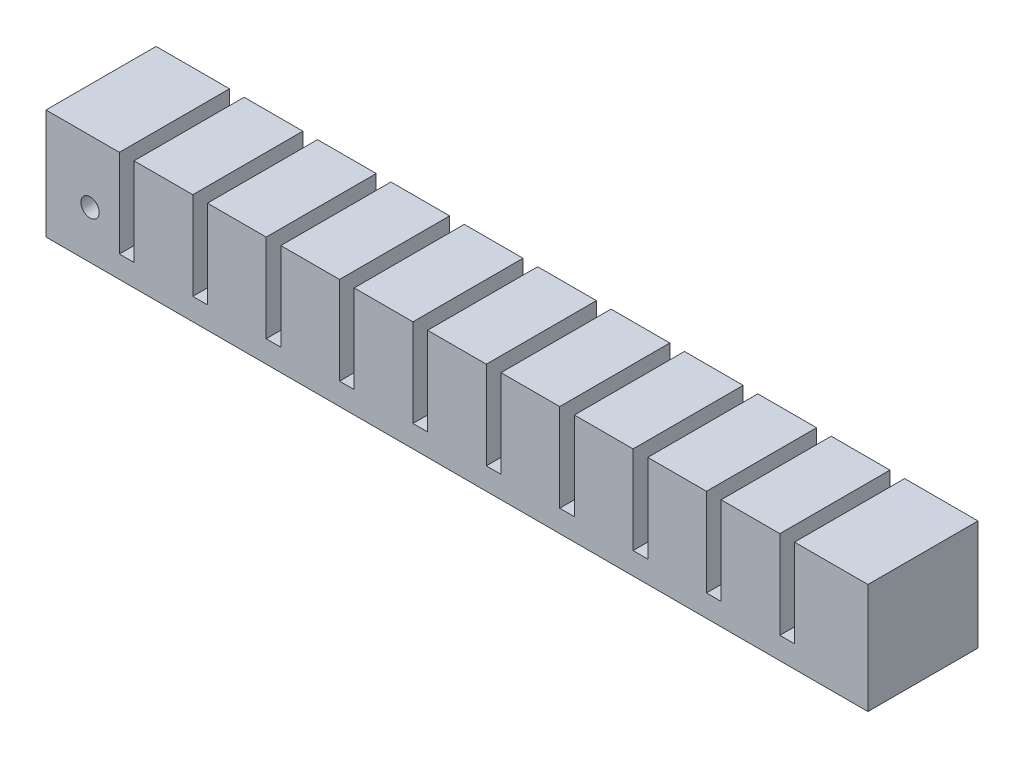
from build123d import *

# Parameters (mm, degrees)
SKETCH1_W                       = 8
SKETCH1_H                       = 15
FIRST_CHAMBER_BLOCK_DEPTH       = 15
SKETCH2_W                       = 6
SKETCH2_H                       = 11
FIRST_CHAMBER_CAVITY_DEPTH      = 13
SKETCH3_W                       = 15
SKETCH3_H                       = 3
CHAMBER_SPACER_DEPTH            = 2
PATTERN_CHAMBERS_COUNT          = 11
PATTERN_CHAMBERS_PITCH          = 10
SKETCH4_W                       = 15
SKETCH4_H                       = 12
THICKEN_END_1_DEPTH             = 2
SKETCH5_W                       = 15
SKETCH5_H                       = 15
THICKEN_END_2_DEPTH             = 2
SKETCH6_W                       = 94
SKETCH6_H                       = 2
CENTRAL_AIR_CHANNEL_DEPTH       = 2
SKETCH7_W                       = 108
SKETCH7_H                       = 13
SKETCH7_W_2                     = 106
SKETCH7_H_2                     = 11
BONDING_RIDGE_DEPTH             = 2
SKETCH9_W                       = 2
SKETCH9_H                       = 2.5
BONDING_BUMPS_DEPTH             = 2
PATTERN_BONDING_BUMPS_COUNT     = 10
PATTERN_BONDING_BUMPS_PITCH     = 10
SKIZZE1_W                       = 112
SKIZZE1_H                       = 15
SCHNITT_LINEAR_AUSTRAGEN1_DEPTH = 113.026782512
SKIZZE4_R                       = 1.25
SCHNITT_LINEAR_AUSTRAGEN3_DEPTH = 112.776562839


with BuildPart() as part:
    # Sketch1 → first chamber block (new body)
    with BuildSketch(Plane.XY):
        with Locations((4, 7.5)):
            Rectangle(SKETCH1_W, SKETCH1_H)
    extrude(amount=FIRST_CHAMBER_BLOCK_DEPTH)

    # Sketch2 → first chamber cavity (cut)
    with BuildSketch(Plane.XZ):
        with Locations((4, 7.5)):
            Rectangle(SKETCH2_W, SKETCH2_H)
    extrude(amount=-FIRST_CHAMBER_CAVITY_DEPTH, mode=Mode.SUBTRACT)

    # Sketch3 → chamber spacer (add)
    with BuildSketch(Plane(origin=(8, 0, 0), x_dir=(0, 0, -1), z_dir=(1, 0, 0))):
        with Locations((-7.5, 1.5)):
            Rectangle(SKETCH3_W, SKETCH3_H)
    extrude(amount=CHAMBER_SPACER_DEPTH)


with BuildPart() as pattern_chambers_1:
    # pattern chambers: pattern copy
    add(part.part.moved(Location(Vector(1, 0, 0) * (1 * PATTERN_CHAMBERS_PITCH))))


with BuildPart() as pattern_chambers_2:
    # pattern chambers: pattern copy
    add(part.part.moved(Location(Vector(1, 0, 0) * (2 * PATTERN_CHAMBERS_PITCH))))


with BuildPart() as pattern_chambers_3:
    # pattern chambers: pattern copy
    add(part.part.moved(Location(Vector(1, 0, 0) * (3 * PATTERN_CHAMBERS_PITCH))))


with BuildPart() as pattern_chambers_4:
    # pattern chambers: pattern copy
    add(part.part.moved(Location(Vector(1, 0, 0) * (4 * PATTERN_CHAMBERS_PITCH))))


with BuildPart() as pattern_chambers_5:
    # pattern chambers: pattern copy
    add(part.part.moved(Location(Vector(1, 0, 0) * (5 * PATTERN_CHAMBERS_PITCH))))


with BuildPart() as pattern_chambers_6:
    # pattern chambers: pattern copy
    add(part.part.moved(Location(Vector(1, 0, 0) * (6 * PATTERN_CHAMBERS_PITCH))))


with BuildPart() as pattern_chambers_7:
    # pattern chambers: pattern copy
    add(part.part.moved(Location(Vector(1, 0, 0) * (7 * PATTERN_CHAMBERS_PITCH))))


with BuildPart() as pattern_chambers_8:
    # pattern chambers: pattern copy
    add(part.part.moved(Location(Vector(1, 0, 0) * (8 * PATTERN_CHAMBERS_PITCH))))


with BuildPart() as pattern_chambers_9:
    # pattern chambers: pattern copy
    add(part.part.moved(Location(Vector(1, 0, 0) * (9 * PATTERN_CHAMBERS_PITCH))))


with BuildPart() as pattern_chambers_10:
    # pattern chambers: pattern copy
    add(part.part.moved(Location(Vector(1, 0, 0) * (10 * PATTERN_CHAMBERS_PITCH))))

    # combine into 1 solid body: union pattern chambers_9, pattern chambers_8, pattern chambers_7, pattern chambers_6, pattern chambers_5, pattern chambers_4, pattern chambers_3, pattern chambers_2, pattern chambers_1, part
    add(pattern_chambers_9.part)
    add(pattern_chambers_8.part)
    add(pattern_chambers_7.part)
    add(pattern_chambers_6.part)
    add(pattern_chambers_5.part)
    add(pattern_chambers_4.part)
    add(pattern_chambers_3.part)
    add(pattern_chambers_2.part)
    add(pattern_chambers_1.part)
    add(part.part)

    # Sketch4 → thicken end 1 (add)
    with BuildSketch(Plane(origin=(108, 0, 0), x_dir=(0, 0, -1), z_dir=(1, 0, 0))):
        with Locations((-7.5, 9)):
            Rectangle(SKETCH4_W, SKETCH4_H)
    extrude(amount=THICKEN_END_1_DEPTH)

    # Sketch5 → thicken end 2 (add)
    with BuildSketch(Plane.ZY):
        with Locations((7.5, 7.5)):
            Rectangle(SKETCH5_W, SKETCH5_H)
    extrude(amount=THICKEN_END_2_DEPTH)

    # Sketch6 → central air channel (cut)
    with BuildSketch(Plane.XZ):
        with Locations((54, 7.5)):
            Rectangle(SKETCH6_W, SKETCH6_H)
    extrude(amount=-CENTRAL_AIR_CHANNEL_DEPTH, mode=Mode.SUBTRACT)

    # Sketch7 → bonding ridge (add)
    with BuildSketch(Plane.XZ):
        with Locations((54, 7.5)):
            Rectangle(SKETCH7_W, SKETCH7_H)
        with Locations((54, 7.5)):
            Rectangle(SKETCH7_W_2, SKETCH7_H_2, mode=Mode.SUBTRACT)
    extrude(amount=BONDING_RIDGE_DEPTH)

    # Sketch9 → bonding bumps (add)
    with BuildSketch(Plane.XZ):
        with Locations((9, 10.75)):
            Rectangle(SKETCH9_W, SKETCH9_H)
        with Locations((9, 4.25)):
            Rectangle(SKETCH9_W, SKETCH9_H)
    bonding_bumps = extrude(amount=BONDING_BUMPS_DEPTH)

    # pattern bonding bumps: bonding bumps ×10
    with Locations(*[(i * PATTERN_BONDING_BUMPS_PITCH, 0, 0) for i in range(1, PATTERN_BONDING_BUMPS_COUNT)]):
        add(bonding_bumps)

    # Skizze1 → Schnitt-Linear austragen1 (cut, through all)
    with BuildSketch(Plane.XZ):
        with Locations((54, 7.5)):
            Rectangle(SKIZZE1_W, SKIZZE1_H)
    extrude(amount=SCHNITT_LINEAR_AUSTRAGEN1_DEPTH, mode=Mode.SUBTRACT)

    # Skizze4 → Schnitt-Linear austragen3 (cut, through all)
    with BuildSketch(Plane.XY.offset(2)):
        with Locations(Location((4, 6.5, 0), (0, 0, 180))):
            Circle(SKIZZE4_R)
    extrude(amount=SCHNITT_LINEAR_AUSTRAGEN3_DEPTH, mode=Mode.SUBTRACT)


solid = pattern_chambers_10.part
